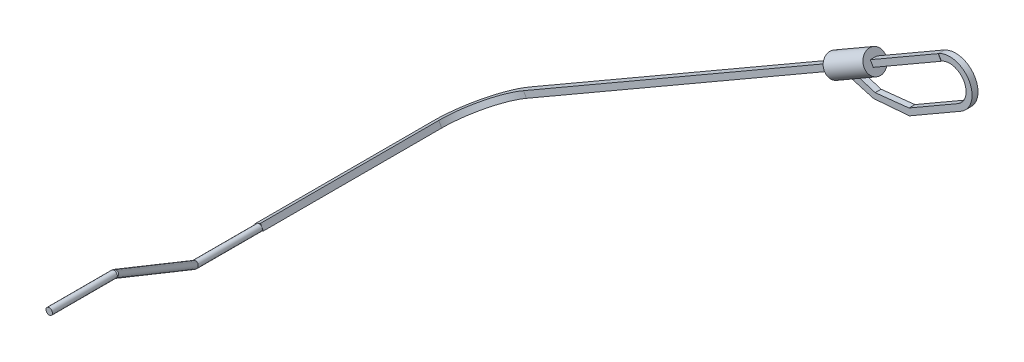
from build123d import *

# Parameters (mm, degrees)
S01_TENDON_CAPTIVE_TAIL_R                      = 0.6
F_01_TENDON_CAPTIVE_TAIL_DEPTH                 = 12
S02_CROSSED_TENDON_R                           = 0.6
F_02_CROSSED_TENDON_DEPTH                      = 33.010681761
S03_TENDON_THROUGH_REAR_GROMMET_R              = 0.6
F_03_TENDON_THROUGH_REAR_GROMMET_DEPTH         = 12
F_04_START                                     = -0.55
F_04_TENDON_RETURN_DEPTH                       = 1.1
F_05_START                                     = 0.55
F_05_REMOVABLE_BACKED_EYE_AROUND_POLISHE_DEPTH = 1.1
S06_DRESSED_EYE_KNOT_ENVELOPE_R                = 2
F_06_DRESSED_EYE_KNOT_ENVELOPE_DEPTH           = 8.5


with BuildPart() as part:
    # S01 - Tendon captive tail → 01 - Tendon captive tail (new body)
    with BuildSketch(Plane.XY.offset(25.959868809)):
        with Locations((-14.854021031, 2.087596514)):
            Circle(S01_TENDON_CAPTIVE_TAIL_R)
    extrude(amount=F_01_TENDON_CAPTIVE_TAIL_DEPTH)

    # S02 - Crossed tendon → 02 - Crossed tendon (add)
    with BuildSketch(Plane(origin=(-5.56891097, -8.552306823, -12.992860813), x_dir=(0.9414814256928209, -0.18532252929363746, -0.28154623991739347), z_dir=(0.33706486775606503, 0.5176384007444039, 0.7864081389452696))):
        with Locations(Location((-21.680567016, -12.529320029, 0), (0, 0, 152.8840726))):
            Circle(S02_CROSSED_TENDON_R)
    extrude(amount=F_02_CROSSED_TENDON_DEPTH)

    # S03 - Tendon through rear grommet → 03 - Tendon through rear grommet (add)
    with BuildSketch(Plane.XY.offset(-12)):
        with Locations(Location((-25.980762114, -15, 0), (0, 0, 146.929477468))):
            Circle(S03_TENDON_THROUGH_REAR_GROMMET_R)
    extrude(amount=F_03_TENDON_THROUGH_REAR_GROMMET_DEPTH)

    # S04 - Tendon return → 04 - Tendon return (add)
    with BuildSketch(Plane(origin=(0, 0, 0), x_dir=(-0.8660254037844386, -0.5000000000000001, 0), z_dir=(0.5000000000000001, -0.8660254037844386, 0)).offset(F_04_START)):
        with BuildLine():
            Line((30.6, 12), (30.6, 45))
            ThreePointArc((30.6, 45), (27.788225099, 51.788225099), (21, 54.6))
            Line((21, 54.6), (-67.598500564, 54.6))
            Line((-67.598500564, 54.6), (-67.598500564, 53.4))
            Line((-67.598500564, 53.4), (21, 53.4))
            ThreePointArc((21, 53.4), (26.939696962, 50.939696962), (29.4, 45))
            Line((29.4, 45), (29.4, 12))
            Line((29.4, 12), (30.6, 12))
        make_face()
    extrude(amount=F_04_TENDON_RETURN_DEPTH)

    # S05 - Removable backed eye around polished clevis sleeve → 05 - Removable backed eye around polished clevis sleeve (add)
    with BuildSketch(Plane.XY.offset(-54).offset(F_05_START)):
        with BuildLine():
            Line((58.093813666, 34.175564254), (58.267018746, 34.275564254))
            ThreePointArc((58.267018746, 34.275564254), (63.936024172, 32.756558829), (62.417018746, 27.087553403))
            Line((62.417018746, 27.087553403), (52.890739305, 21.587553403))
            Line((52.890739305, 21.587553403), (46.269586882, 21.055725804))
            Line((46.269586882, 21.055725804), (40.755485267, 22.606429959))
            Line((40.755485267, 22.606429959), (41.221510671, 23.799250282))
            Line((41.221510671, 23.799250282), (46.562407205, 22.148546127))
            Line((46.562407205, 22.148546127), (52.817053277, 22.815181347))
            Line((52.817053277, 22.815181347), (61.867018746, 28.040181347))
            ThreePointArc((61.867018746, 28.040181347), (62.983396228, 32.206558829), (58.817018746, 33.32293631))
            Line((58.817018746, 33.32293631), (58.643813666, 33.22293631))
            Line((58.643813666, 33.22293631), (58.093813666, 34.175564254))
        make_face()
    extrude(amount=-F_05_REMOVABLE_BACKED_EYE_AROUND_POLISHE_DEPTH)

    # S06 - Dressed eye knot envelope → 06 - Dressed eye knot envelope (add)
    with BuildSketch(Plane(origin=(38.623434459, 22.299250282, 0), x_dir=(0, 0, -1), z_dir=(0.8660254037844386, 0.5000000000000001, 0))):
        with Locations(Location((54, 0, 0), (0, 0, 90))):
            Circle(S06_DRESSED_EYE_KNOT_ENVELOPE_R)
    extrude(amount=F_06_DRESSED_EYE_KNOT_ENVELOPE_DEPTH)


solid = part.part
